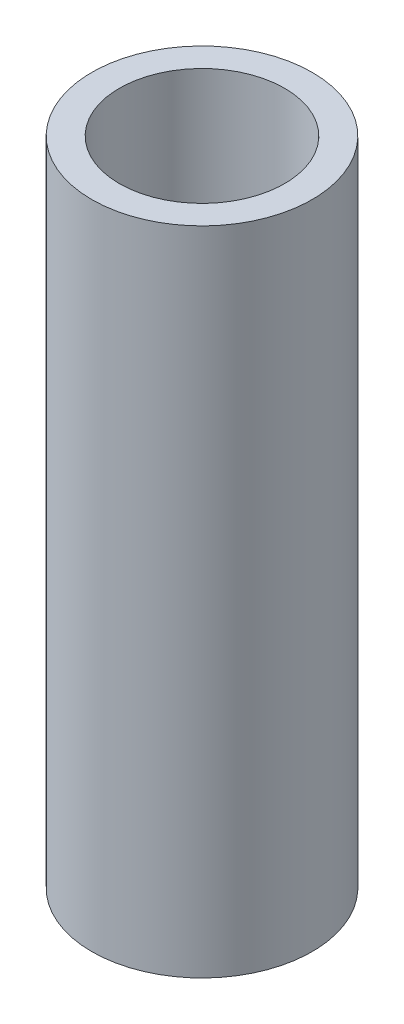
from build123d import *

# Parameters (mm, degrees)
SWEEP1_PROFILE_R   = 10
SKETCH3_R          = 7.5
CUT_EXTRUDE2_DEPTH = 70


with BuildPart() as part:
    # Sweep1: sweep along a path in Sketch1
    with BuildLine(Plane.XY) as sweep1_path:
        Line((0, 0), (0, -59.1089185))
    # Sweep1 profile (on start of the path) → Sweep1 (sweep)
    with BuildSketch(Plane(origin=(0, 0, 0), x_dir=(0, 0, -1), z_dir=(0, -1, 0))):
        Circle(SWEEP1_PROFILE_R)
    sweep(path=sweep1_path.line)

    # Sketch3 → Cut-Extrude2 (cut)
    with BuildSketch(Plane(origin=(0, 0, 0), x_dir=(1, 0, 0), z_dir=(0, 1, 0))):
        with Locations(Location((0, 0, 0), (0, 0, 270))):
            Circle(SKETCH3_R)
    extrude(amount=-CUT_EXTRUDE2_DEPTH, mode=Mode.SUBTRACT)


solid = part.part
